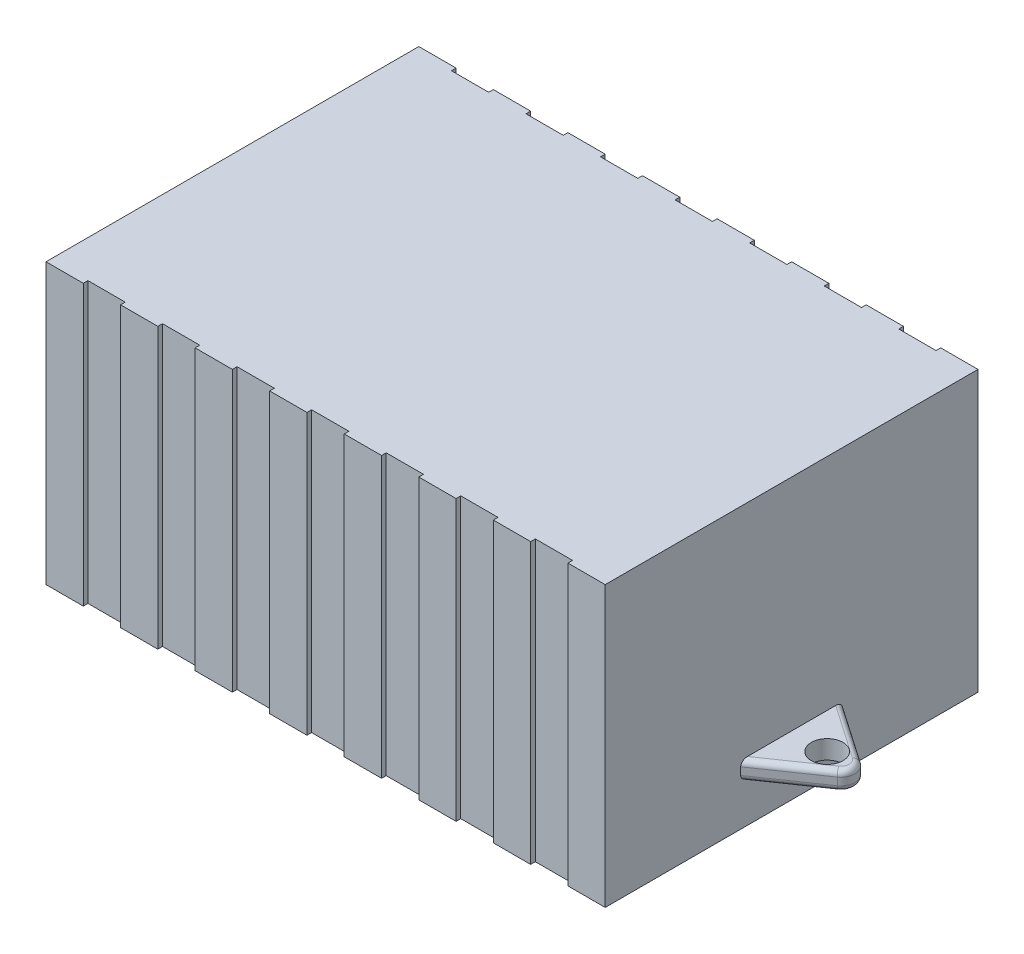
from build123d import *

# Parameters (mm, degrees)
BOSS_EXTRUDE1_DEPTH = 381
BOSS_EXTRUDE2_DEPTH = 12.7
SKETCH4_R           = 21.592305898
CUT_EXTRUDE1_DEPTH  = 25.4
FILLET1_R           = 7.62
SKETCH5_R           = 25.4
CUT_EXTRUDE2_DEPTH  = 127


with BuildPart() as part:
    # Sketch2 → Boss-Extrude1 (new body)
    with BuildSketch(Plane(origin=(0, 0, 0), x_dir=(1, 0, 0), z_dir=(0, 1, 0))):
        Polygon((-381, 254), (-330.2, 254), (-330.2, 247.65), (-279.4, 247.65), (-279.4, 254), (-228.6, 254), (-228.6, 247.65), (-177.8, 247.65), (-177.8, 254), (-127, 254), (-127, 247.65), (-76.2, 247.65), (-76.2, 254), (-25.4, 254), (-25.4, 247.65), (25.4, 247.65), (25.4, 254), (76.2, 254), (76.2, 247.65), (127, 247.65), (127, 254), (177.8, 254), (177.8, 247.65), (228.6, 247.65), (228.6, 254), (279.4, 254), (279.4, 247.65), (330.2, 247.65), (330.2, 254), (381, 254), (381, -254), (330.2, -254), (330.2, -247.65), (279.4, -247.65), (279.4, -254), (228.6, -254), (228.6, -247.65), (177.8, -247.65), (177.8, -254), (127, -254), (127, -247.65), (76.2, -247.65), (76.2, -254), (25.4, -254), (25.4, -247.65), (-25.4, -247.65), (-25.4, -254), (-76.2, -254), (-76.2, -247.65), (-127, -247.65), (-127, -254), (-177.8, -254), (-177.8, -247.65), (-228.6, -247.65), (-228.6, -254), (-279.4, -254), (-279.4, -247.65), (-330.2, -247.65), (-330.2, -254), (-381, -254), align=None)
    extrude(amount=BOSS_EXTRUDE1_DEPTH)

    # Sketch3 → Boss-Extrude2 (add, symmetric)
    with BuildSketch(Plane(origin=(0, 68.58, 0), x_dir=(-1, 0, 0), z_dir=(0, -1, 0))):
        with BuildLine():
            Line((-458.892414986, -15.684101321), (-381, -69.382839719))
            Line((-381, -69.382839719), (-381, 69.382839719))
            Line((-381, 69.382839719), (-458.892414986, 15.684101321))
            ThreePointArc((-458.892414986, 15.684101321), (-467.12985443, 0), (-458.892414986, -15.684101321))
        make_face()
    extrude(amount=BOSS_EXTRUDE2_DEPTH, both=True)

    # Sketch4 → Cut-Extrude1 (cut)
    with BuildSketch(Plane(origin=(0, 81.28, 0), x_dir=(1, 0, 0), z_dir=(0, 1, 0))):
        with Locations(Location((429.496611066, 0, 0), (0, 0, 270))):
            Circle(SKETCH4_R)
    extrude(amount=-CUT_EXTRUDE1_DEPTH, mode=Mode.SUBTRACT)

    # Fillet1
    fillet1_edges = [part.edges().sort_by_distance(p)[0] for p in [
        (419.946207493, 81.28, -42.53347052),
        (467.12985443, 81.28, 0),
        (419.946207493, 81.28, 42.53347052),
        (419.946207493, 55.88, -42.53347052),
        (467.12985443, 55.88, 0),
        (419.946207493, 55.88, 42.53347052),
    ]]
    fillet(fillet1_edges, radius=FILLET1_R)

    # Sketch5 → Cut-Extrude2 (cut)
    with BuildSketch(Plane.XZ):
        with Locations(Location((-314.062017965, -177.8, 0), (0, 0, 270))):
            Circle(SKETCH5_R)
        with Locations(Location((244.737982035, -177.8, 0), (0, 0, 270))):
            Circle(SKETCH5_R)
        with Locations(Location((244.737982035, 177.8, 0), (0, 0, 90))):
            Circle(SKETCH5_R)
        with Locations(Location((-314.062017965, 177.8, 0), (0, 0, 90))):
            Circle(SKETCH5_R)
    extrude(amount=-CUT_EXTRUDE2_DEPTH, mode=Mode.SUBTRACT)


solid = part.part
